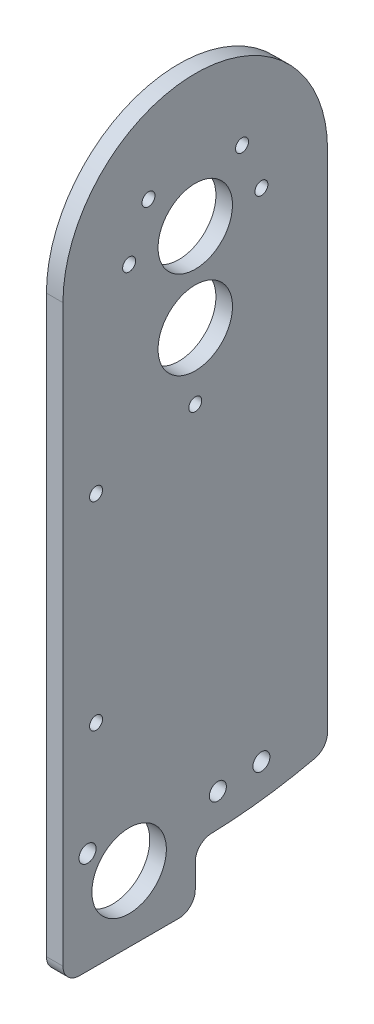
from build123d import *
from build123d.topology import SkipClean

# Parameters (mm, degrees)
SKETCH1_R                  = 14.2875
BOSS_EXTRUDE1_DEPTH        = 6.35
F_0_257_DIAMETER_HOLE1_D   = 6.5278
F_9_0_196_DIAMETER_HOLE1_D = 4.9784
F_9_0_196_DIAMETER_HOLE2_D = 4.9784
BOSS_EXTRUDE3_START        = -6.35
BOSS_EXTRUDE3_DEPTH        = 6.35
CUT_EXTRUDE1_START         = -6.35
SKETCH11_R                 = 14.2875
CUT_EXTRUDE1_DEPTH         = 6.35
FILLET1_R                  = 6.35


with BuildPart() as part:
    # Sketch1 → Boss-Extrude1 (new body)
    with BuildSketch(Plane.YZ):
        with BuildLine():
            Line((0, -50.8), (-198.714420778, -50.8))
            ThreePointArc((-198.714420778, -50.8), (-205.105, 0), (-198.714420778, 50.8))
            Line((-198.714420778, 50.8), (0, 50.8))
            ThreePointArc((0, 50.8), (50.8, 0), (0, -50.8))
        make_face()
        with Locations(Location((0, 0, 0), (0, 0, 270))):
            Circle(SKETCH1_R, mode=Mode.SUBTRACT)
        with Locations(Location((-33.782, 0, 0), (0, 0, 270))):
            Circle(SKETCH1_R, mode=Mode.SUBTRACT)
    extrude(amount=BOSS_EXTRUDE1_DEPTH)

    # F (0.257) Diameter Hole1 (through all)
    with Locations(Plane.YZ.offset(6.35)):
        with Locations((0, 0), (-190.721063402, -25.4), (-192.209068041, -8.680909393), (-187.906487547, 41.362252872)):
            Hole(F_0_257_DIAMETER_HOLE1_D / 2)

    # #9 (0.196) Diameter Hole1 (through all)
    with Locations(Plane.YZ.offset(6.35)):
        with Locations((-146.05, 38.1), (-69.85, 38.1)):
            Hole(F_9_0_196_DIAMETER_HOLE1_D / 2)

    # #9 (0.196) Diameter Hole2 (through all)
    with Locations(Plane(origin=(0, 0, 0), x_dir=(0, -1, 0), z_dir=(-1, 0, 0))):
        with Locations((59.182, 0), (0, 25.4), (0, -25.4), (-17.960512242, -17.960512242), (-17.960512242, 17.960512242)):
            Hole(F_9_0_196_DIAMETER_HOLE2_D / 2)

    # Sketch10 → Boss-Extrude3 (add)
    with BuildSketch(Plane.YZ.offset(6.35).offset(BOSS_EXTRUDE3_START)):
        with BuildLine():
            Line((-198.714420778, 50.8), (-227.006249903, 50.8))
            Line((-227.006249903, 50.8), (-227.006249903, 0))
            Line((-227.006249903, 0), (-205.105, 0))
            ThreePointArc((-205.105, 0), (-205.024737282, 5.737432126), (-204.784011946, 11.470373851))
            ThreePointArc((-204.784011946, 11.470373851), (-215.781689349, 27.1859375), (-201.229613759, 39.68253484))
            Line((-201.229613759, 39.68253484), (-198.714420778, 50.8))
        make_face()
    extrude(amount=BOSS_EXTRUDE3_DEPTH)

    # Sketch11 → Cut-Extrude1 (cut)
    with SkipClean():  # the faces are left unmerged after this step: merging them gives an invalid solid
        with BuildSketch(Plane.YZ.offset(6.35).offset(CUT_EXTRUDE1_START)):
            with Locations(Location((-201.606249903, 25.4, 0), (0, 0, 90))):
                Circle(SKETCH11_R)
        extrude(amount=CUT_EXTRUDE1_DEPTH, mode=Mode.SUBTRACT)

    # Fillet1
    fillet1_edges = [part.edges().sort_by_distance(p)[0] for p in [
        (3.175, -198.714420778, -50.8),
        (3.175, -205.105, 0),
        (3.175, -227.006249903, 0),
        (3.175, -227.006249903, 50.8),
    ]]
    fillet(fillet1_edges, radius=FILLET1_R)


solid = part.part
